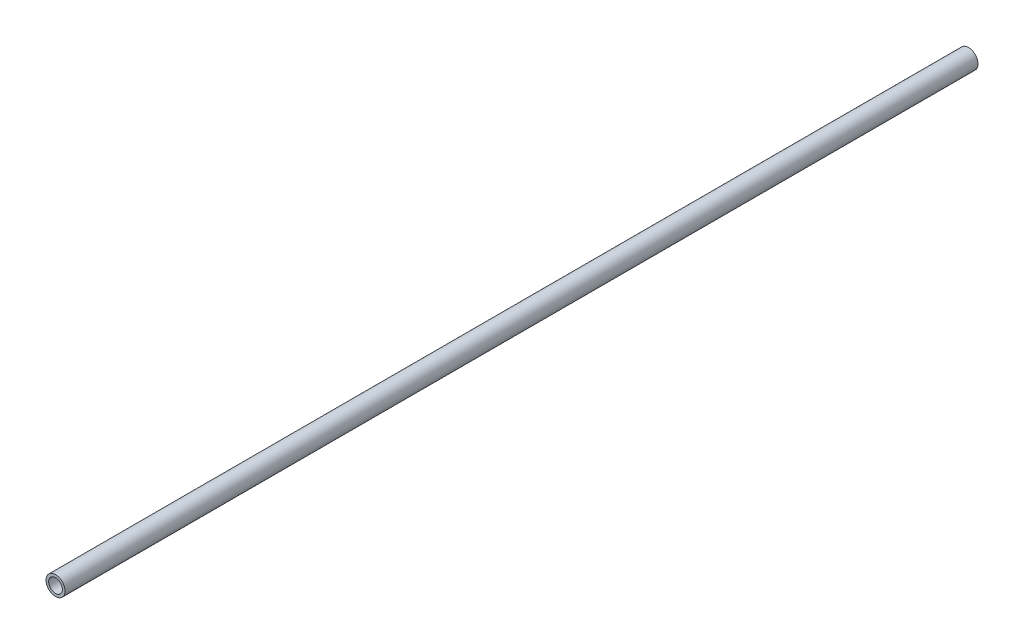
from build123d import *

# Parameters (mm, degrees)
SKETCH3_R           = 3.175
SKETCH3_R_2         = 2.286
BOSS_EXTRUDE1_DEPTH = 152.4


with BuildPart() as part:
    # Sketch3 → Boss-Extrude1 (new, symmetric)
    with BuildSketch(Plane.XY):
        with Locations(Location((0, 0, 0), (0, 0, 180))):
            Circle(SKETCH3_R)
        with Locations(Location((0, 0, 0), (0, 0, 180))):
            Circle(SKETCH3_R_2, mode=Mode.SUBTRACT)
    extrude(amount=BOSS_EXTRUDE1_DEPTH, both=True)


solid = part.part
